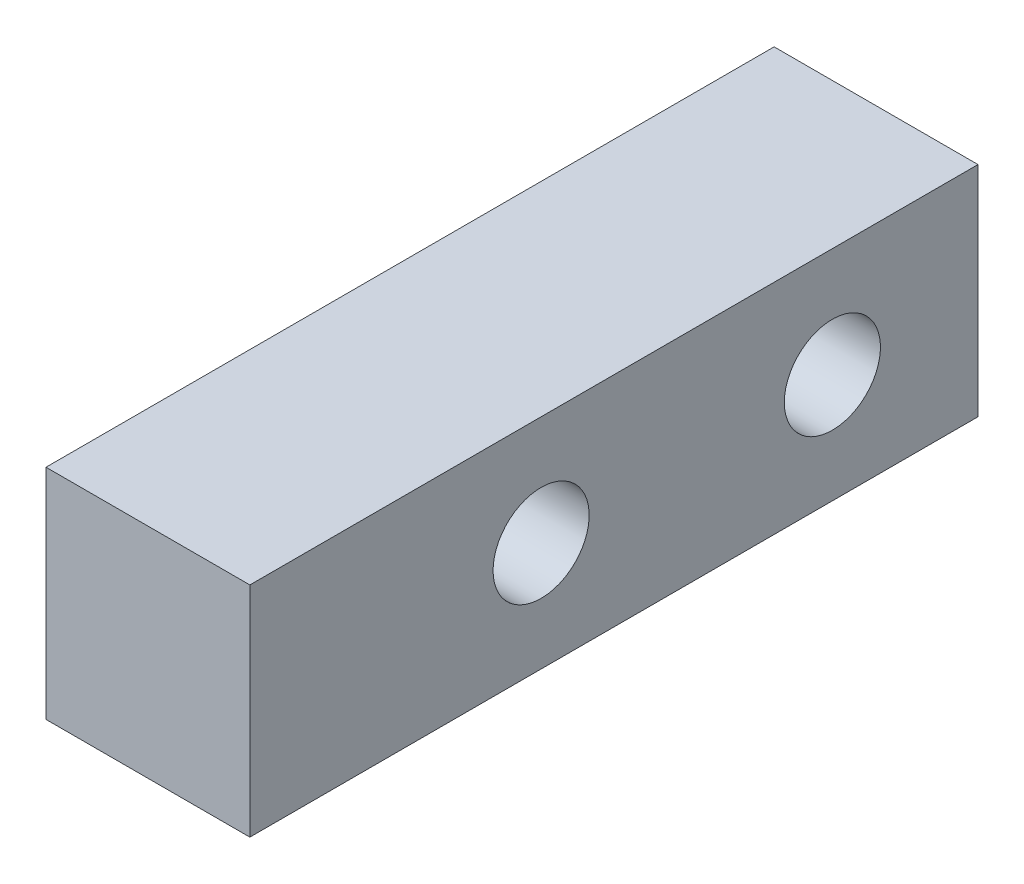
from build123d import *

# Parameters (mm, degrees)
SKETCH1_W                              = 14
SKETCH1_H                              = 15
BOSS_EXTRUDE1_DEPTH                    = 50
CBORE_FOR_M6_HEX_HEAD_BOLT1_AT_2_COUNT = 2
CBORE_FOR_M6_HEX_HEAD_BOLT1_AT_2_PITCH = 20


with BuildPart() as part:
    # Sketch1 → Boss-Extrude1 (new body)
    with BuildSketch(Plane.XY):
        Rectangle(SKETCH1_W, SKETCH1_H)
    extrude(amount=BOSS_EXTRUDE1_DEPTH)

    # Sketch3 → CBORE for M6 Hex Head Bolt1 (revolve, cut)
    with BuildSketch(Plane(origin=(-7, 0, 10), x_dir=(0, 0, 1), z_dir=(0, 1, 0))):
        Polygon((0, 0), (0, 14), (3.3, 14), (3.3, 4), (7.2735, 4), (7.2735, 0.025), (7.2985, 0), align=None)
    cbore_for_m6_hex_head_bolt1 = revolve(axis=Axis((-13.35, 0, 10), (1, 0, 0)), mode=Mode.SUBTRACT)

    # CBORE for M6 Hex Head Bolt1 at 2: CBORE for M6 Hex Head Bolt1 ×2
    with Locations(*[(0, 0, i * CBORE_FOR_M6_HEX_HEAD_BOLT1_AT_2_PITCH) for i in range(1, CBORE_FOR_M6_HEX_HEAD_BOLT1_AT_2_COUNT)]):
        add(cbore_for_m6_hex_head_bolt1, mode=Mode.SUBTRACT)


solid = part.part
